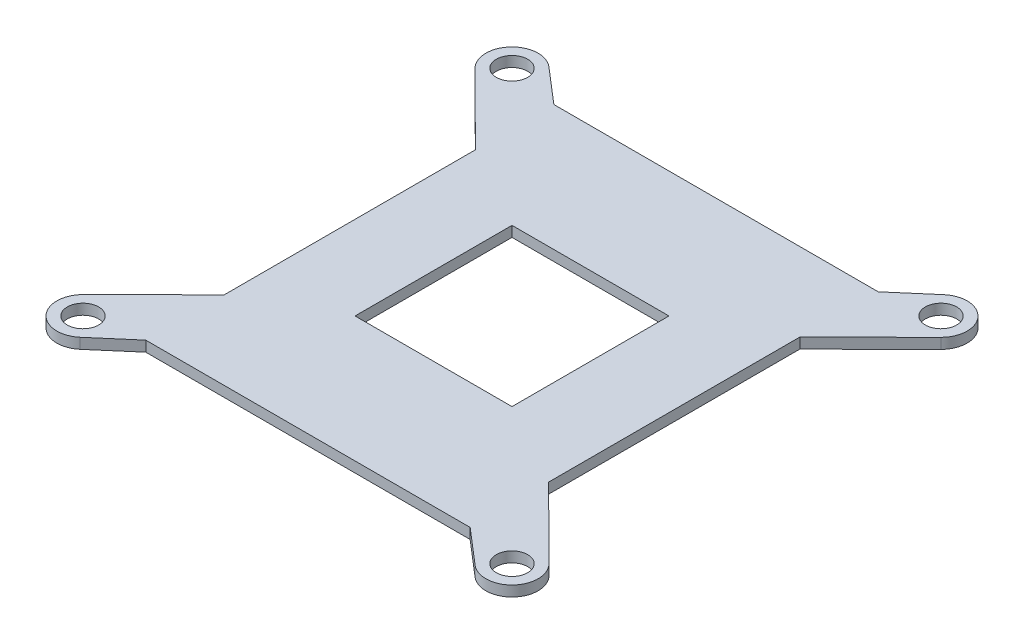
from build123d import *

# Parameters (mm, degrees)
CROQUIS1_R              = 3
CROQUIS1_W              = 30
CROQUIS1_H              = 30
SALIENTE_EXTRUIR1_DEPTH = 2


with BuildPart() as part:
    # Croquis1 → Saliente-Extruir1 (new body)
    with BuildSketch(Plane(origin=(0, 0, 0), x_dir=(1, 0, 0), z_dir=(0, 1, 0))):
        with BuildLine():
            Line((-31, 39), (-37.741519768, 44.792401162))
            ThreePointArc((-37.741519768, 44.792401162), (-44.671057551, 44.394604021), (-44.526212448, 37.455169148))
            Line((-44.526212448, 37.455169148), (-31, 24))
            Line((-31, 24), (-31, -24))
            Line((-31, -24), (-44.526212448, -37.455169148))
            ThreePointArc((-44.526212448, -37.455169148), (-44.671057551, -44.394604021), (-37.741519768, -44.792401162))
            Line((-37.741519768, -44.792401162), (-31, -39))
            Line((-31, -39), (31, -39))
            Line((31, -39), (37.741519768, -44.792401162))
            ThreePointArc((37.741519768, -44.792401162), (44.671057551, -44.394604021), (44.526212448, -37.455169148))
            Line((44.526212448, -37.455169148), (31, -24))
            Line((31, -24), (31, 24))
            Line((31, 24), (44.526212448, 37.455169148))
            ThreePointArc((44.526212448, 37.455169148), (44.671057551, 44.394604021), (37.741519768, 44.792401162))
            Line((37.741519768, 44.792401162), (31, 39))
            Line((31, 39), (-31, 39))
        make_face()
        with Locations(Location((-41, 41, 0), (0, 0, 270))):
            Circle(CROQUIS1_R, mode=Mode.SUBTRACT)
        with Locations(Location((41, 41, 0), (0, 0, 270))):
            Circle(CROQUIS1_R, mode=Mode.SUBTRACT)
        with Locations(Location((41, -41, 0), (0, 0, 270))):
            Circle(CROQUIS1_R, mode=Mode.SUBTRACT)
        with Locations(Location((-41, -41, 0), (0, 0, 270))):
            Circle(CROQUIS1_R, mode=Mode.SUBTRACT)
        Rectangle(CROQUIS1_W, CROQUIS1_H, mode=Mode.SUBTRACT)
    extrude(amount=SALIENTE_EXTRUIR1_DEPTH)


solid = part.part
